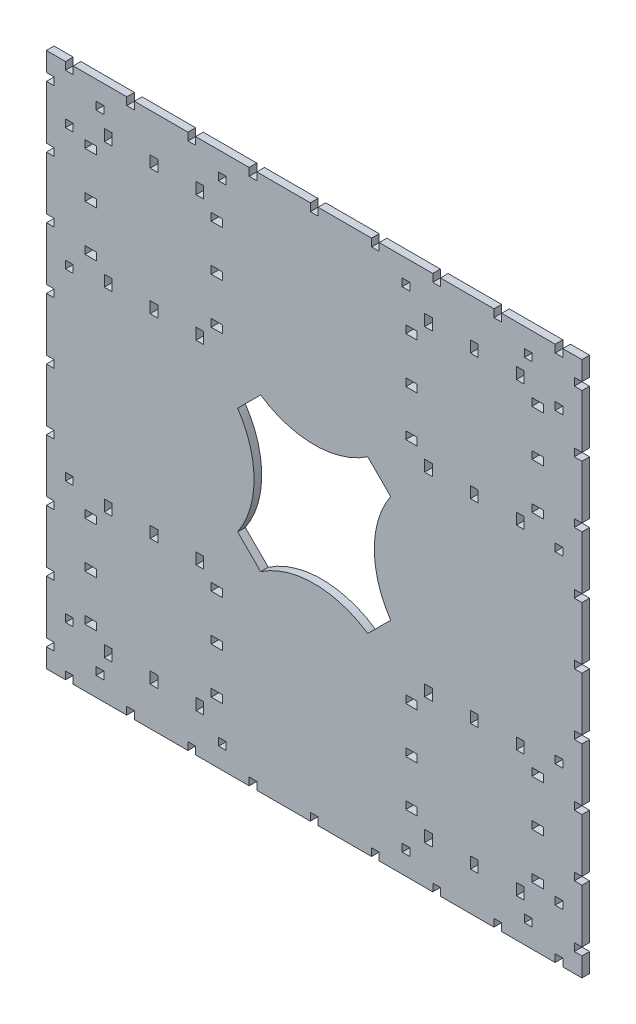
from build123d import *

# Parameters (mm, degrees)
SKETCH1_W           = 3
SKETCH1_H           = 4.511161963
SKETCH1_W_2         = 4.511161963
SKETCH1_H_2         = 3
SKETCH1_H_3         = 4.432816402
SKETCH1_W_3         = 4.432816402
BOSS_EXTRUDE1_DEPTH = 3


with BuildPart() as part:
    # Sketch1 → Boss-Extrude1 (new body)
    with BuildSketch(Plane.XY):
        Polygon((6, 202.5), (3, 202.5), (3, 181.5), (6, 181.5), (6, 178.5), (3, 178.5), (3, 157.5), (6, 157.5), (6, 154.5), (3, 154.5), (3, 133.5), (6, 133.5), (6, 130.5), (3, 130.5), (3, 109.5), (6, 109.5), (6, 106.5), (3, 106.5), (3, 85.5), (6, 85.5), (6, 82.5), (3, 82.5), (3, 61.5), (6, 61.5), (6, 58.5), (3, 58.5), (3, 37.5), (6, 37.5), (6, 34.5), (3, 34.5), (3, 13.5), (6, 13.5), (6, 10.5), (3, 10.5), (3, 3), (10.5, 3), (10.5, 6), (13.5, 6), (13.5, 3), (34.5, 3), (34.5, 6), (37.5, 6), (37.5, 3), (58.5, 3), (58.5, 6), (61.5, 6), (61.5, 3), (82.5, 3), (82.5, 6), (85.5, 6), (85.5, 3), (106.5, 3), (106.5, 6), (109.5, 6), (109.5, 3), (130.5, 3), (130.5, 6), (133.5, 6), (133.5, 3), (154.5, 3), (154.5, 6), (157.5, 6), (157.5, 3), (178.5, 3), (178.5, 6), (181.5, 6), (181.5, 3), (202.5, 3), (202.5, 6), (205.5, 6), (205.5, 3), (213, 3), (213, 10.5), (210, 10.5), (210, 13.5), (213, 13.5), (213, 34.5), (210, 34.5), (210, 37.5), (213, 37.5), (213, 58.5), (210, 58.5), (210, 61.5), (213, 61.5), (213, 82.5), (210, 82.5), (210, 85.5), (213, 85.5), (213, 106.5), (210, 106.5), (210, 109.5), (213, 109.5), (213, 130.5), (210, 130.5), (210, 133.5), (213, 133.5), (213, 154.5), (210, 154.5), (210, 157.5), (213, 157.5), (213, 178.5), (210, 178.5), (210, 181.5), (213, 181.5), (213, 202.5), (210, 202.5), (210, 205.5), (213, 205.5), (213, 213), (205.5, 213), (205.5, 210), (202.5, 210), (202.5, 213), (181.5, 213), (181.5, 210), (178.5, 210), (178.5, 213), (157.5, 213), (157.5, 210), (154.5, 210), (154.5, 213), (133.5, 213), (133.5, 210), (130.5, 210), (130.5, 213), (109.5, 213), (109.5, 210), (106.5, 210), (106.5, 213), (85.5, 213), (85.5, 210), (82.5, 210), (82.5, 213), (61.5, 213), (61.5, 210), (58.5, 210), (58.5, 213), (37.5, 213), (37.5, 210), (34.5, 210), (34.5, 213), (13.5, 213), (13.5, 210), (10.5, 210), (10.5, 213), (3, 213), (3, 205.5), (6, 205.5), align=None)
        with Locations((45.194363377, 20.384775548)):
            Rectangle(SKETCH1_W, SKETCH1_H, mode=Mode.SUBTRACT)
        with Locations((27.194363377, 20.384775548)):
            Rectangle(SKETCH1_W, SKETCH1_H, mode=Mode.SUBTRACT)
        with Locations((195.615224453, 63.194363377)):
            Rectangle(SKETCH1_W_2, SKETCH1_H_2, mode=Mode.SUBTRACT)
        with Locations((170.805636623, 195.615224453)):
            Rectangle(SKETCH1_W, SKETCH1_H, mode=Mode.SUBTRACT)
        with Locations((188.805636623, 195.615224453)):
            Rectangle(SKETCH1_W, SKETCH1_H, mode=Mode.SUBTRACT)
        with Locations((170.805636623, 20.384775548)):
            Rectangle(SKETCH1_W, SKETCH1_H, mode=Mode.SUBTRACT)
        with Locations((152.805636623, 20.384775548)):
            Rectangle(SKETCH1_W, SKETCH1_H, mode=Mode.SUBTRACT)
        with Locations((188.805636623, 20.384775548)):
            Rectangle(SKETCH1_W, SKETCH1_H, mode=Mode.SUBTRACT)
        with Locations((195.615224453, 170.805636623)):
            Rectangle(SKETCH1_W_2, SKETCH1_H_2, mode=Mode.SUBTRACT)
        with Locations((195.615224453, 152.805636623)):
            Rectangle(SKETCH1_W_2, SKETCH1_H_2, mode=Mode.SUBTRACT)
        with Locations((195.615224453, 188.805636623)):
            Rectangle(SKETCH1_W_2, SKETCH1_H_2, mode=Mode.SUBTRACT)
        with Locations((45.194363377, 195.615224453)):
            Rectangle(SKETCH1_W, SKETCH1_H, mode=Mode.SUBTRACT)
        with Locations((63.194363377, 195.615224453)):
            Rectangle(SKETCH1_W, SKETCH1_H, mode=Mode.SUBTRACT)
        with Locations((27.194363377, 195.615224453)):
            Rectangle(SKETCH1_W, SKETCH1_H, mode=Mode.SUBTRACT)
        with Locations((20.384775548, 152.805636623)):
            Rectangle(SKETCH1_W_2, SKETCH1_H_2, mode=Mode.SUBTRACT)
        with Locations((72, 204)):
            Rectangle(SKETCH1_W, SKETCH1_H_2, mode=Mode.SUBTRACT)
        with Locations((192, 204)):
            Rectangle(SKETCH1_W, SKETCH1_H_2, mode=Mode.SUBTRACT)
        with Locations((24, 204)):
            Rectangle(SKETCH1_W, SKETCH1_H_2, mode=Mode.SUBTRACT)
        with Locations((144, 204)):
            Rectangle(SKETCH1_W, SKETCH1_H_2, mode=Mode.SUBTRACT)
        with Locations((204, 144)):
            Rectangle(SKETCH1_W, SKETCH1_H_2, mode=Mode.SUBTRACT)
        with Locations((144, 12)):
            Rectangle(SKETCH1_W, SKETCH1_H_2, mode=Mode.SUBTRACT)
        with Locations((12, 72)):
            Rectangle(SKETCH1_W, SKETCH1_H_2, mode=Mode.SUBTRACT)
        with Locations((204, 192)):
            Rectangle(SKETCH1_W, SKETCH1_H_2, mode=Mode.SUBTRACT)
        with Locations((192, 12)):
            Rectangle(SKETCH1_W, SKETCH1_H_2, mode=Mode.SUBTRACT)
        with Locations((12, 24)):
            Rectangle(SKETCH1_W, SKETCH1_H_2, mode=Mode.SUBTRACT)
        with Locations((204, 24)):
            Rectangle(SKETCH1_W, SKETCH1_H_2, mode=Mode.SUBTRACT)
        with Locations((24, 12)):
            Rectangle(SKETCH1_W, SKETCH1_H_2, mode=Mode.SUBTRACT)
        with Locations((12, 192)):
            Rectangle(SKETCH1_W, SKETCH1_H_2, mode=Mode.SUBTRACT)
        with Locations((204, 72)):
            Rectangle(SKETCH1_W, SKETCH1_H_2, mode=Mode.SUBTRACT)
        with Locations((72, 12)):
            Rectangle(SKETCH1_W, SKETCH1_H_2, mode=Mode.SUBTRACT)
        with Locations((12, 144)):
            Rectangle(SKETCH1_W, SKETCH1_H_2, mode=Mode.SUBTRACT)
        with Locations((20.384775548, 27.194363377)):
            Rectangle(SKETCH1_W_2, SKETCH1_H_2, mode=Mode.SUBTRACT)
        with Locations((20.384775548, 63.194363377)):
            Rectangle(SKETCH1_W_2, SKETCH1_H_2, mode=Mode.SUBTRACT)
        with Locations((20.384775548, 45.194363377)):
            Rectangle(SKETCH1_W_2, SKETCH1_H_2, mode=Mode.SUBTRACT)
        with Locations((20.384775548, 188.805636623)):
            Rectangle(SKETCH1_W_2, SKETCH1_H_2, mode=Mode.SUBTRACT)
        with Locations((20.384775548, 170.805636623)):
            Rectangle(SKETCH1_W_2, SKETCH1_H_2, mode=Mode.SUBTRACT)
        with Locations((152.805636623, 195.615224453)):
            Rectangle(SKETCH1_W, SKETCH1_H, mode=Mode.SUBTRACT)
        with Locations((195.615224453, 27.194363377)):
            Rectangle(SKETCH1_W_2, SKETCH1_H_2, mode=Mode.SUBTRACT)
        with Locations((195.615224453, 45.194363377)):
            Rectangle(SKETCH1_W_2, SKETCH1_H_2, mode=Mode.SUBTRACT)
        with Locations((63.194363377, 20.384775548)):
            Rectangle(SKETCH1_W, SKETCH1_H, mode=Mode.SUBTRACT)
        with Locations((27.194363377, 146.154397233)):
            Rectangle(SKETCH1_W, SKETCH1_H_3, mode=Mode.SUBTRACT)
        with Locations((45.194363377, 146.154397233)):
            Rectangle(SKETCH1_W, SKETCH1_H_3, mode=Mode.SUBTRACT)
        with Locations((63.194363377, 146.154397233)):
            Rectangle(SKETCH1_W, SKETCH1_H_3, mode=Mode.SUBTRACT)
        with Locations((69.845602767, 152.805636623)):
            Rectangle(SKETCH1_W_3, SKETCH1_H_2, mode=Mode.SUBTRACT)
        with Locations((69.845602767, 188.805636623)):
            Rectangle(SKETCH1_W_3, SKETCH1_H_2, mode=Mode.SUBTRACT)
        with Locations((69.845602767, 170.805636623)):
            Rectangle(SKETCH1_W_3, SKETCH1_H_2, mode=Mode.SUBTRACT)
        with Locations((146.154397233, 188.805636623)):
            Rectangle(SKETCH1_W_3, SKETCH1_H_2, mode=Mode.SUBTRACT)
        with Locations((146.154397233, 170.805636623)):
            Rectangle(SKETCH1_W_3, SKETCH1_H_2, mode=Mode.SUBTRACT)
        with Locations((146.154397233, 152.805636623)):
            Rectangle(SKETCH1_W_3, SKETCH1_H_2, mode=Mode.SUBTRACT)
        with Locations((188.805636623, 69.845602767)):
            Rectangle(SKETCH1_W, SKETCH1_H_3, mode=Mode.SUBTRACT)
        with Locations((170.805636623, 69.845602767)):
            Rectangle(SKETCH1_W, SKETCH1_H_3, mode=Mode.SUBTRACT)
        with Locations((152.805636623, 69.845602767)):
            Rectangle(SKETCH1_W, SKETCH1_H_3, mode=Mode.SUBTRACT)
        with Locations((69.845602767, 27.194363377)):
            Rectangle(SKETCH1_W_3, SKETCH1_H_2, mode=Mode.SUBTRACT)
        with Locations((69.845602767, 45.194363377)):
            Rectangle(SKETCH1_W_3, SKETCH1_H_2, mode=Mode.SUBTRACT)
        with Locations((69.845602767, 63.194363377)):
            Rectangle(SKETCH1_W_3, SKETCH1_H_2, mode=Mode.SUBTRACT)
        with Locations((152.805636623, 146.154397233)):
            Rectangle(SKETCH1_W, SKETCH1_H_3, mode=Mode.SUBTRACT)
        with Locations((188.805636623, 146.154397233)):
            Rectangle(SKETCH1_W, SKETCH1_H_3, mode=Mode.SUBTRACT)
        with Locations((170.805636623, 146.154397233)):
            Rectangle(SKETCH1_W, SKETCH1_H_3, mode=Mode.SUBTRACT)
        with Locations((146.154397233, 63.194363377)):
            Rectangle(SKETCH1_W_3, SKETCH1_H_2, mode=Mode.SUBTRACT)
        with Locations((146.154397233, 27.194363377)):
            Rectangle(SKETCH1_W_3, SKETCH1_H_2, mode=Mode.SUBTRACT)
        with Locations((146.154397233, 45.194363377)):
            Rectangle(SKETCH1_W_3, SKETCH1_H_2, mode=Mode.SUBTRACT)
        with Locations((63.194363377, 69.845602767)):
            Rectangle(SKETCH1_W, SKETCH1_H_3, mode=Mode.SUBTRACT)
        with Locations((27.194363377, 69.845602767)):
            Rectangle(SKETCH1_W, SKETCH1_H_3, mode=Mode.SUBTRACT)
        with Locations((45.194363377, 69.845602767)):
            Rectangle(SKETCH1_W, SKETCH1_H_3, mode=Mode.SUBTRACT)
        with BuildLine():
            Line((138, 87), (129, 78))
            ThreePointArc((129, 78), (108, 84.431527234), (87, 78))
            Line((87, 78), (78, 87))
            ThreePointArc((78, 87), (84.431527234, 108), (78, 129))
            Line((78, 129), (87, 138))
            ThreePointArc((87, 138), (108, 131.568472766), (129, 138))
            Line((129, 138), (138, 129))
            ThreePointArc((138, 129), (131.568472766, 108), (138, 87))
        make_face(mode=Mode.SUBTRACT)
    extrude(amount=BOSS_EXTRUDE1_DEPTH)


solid = part.part
